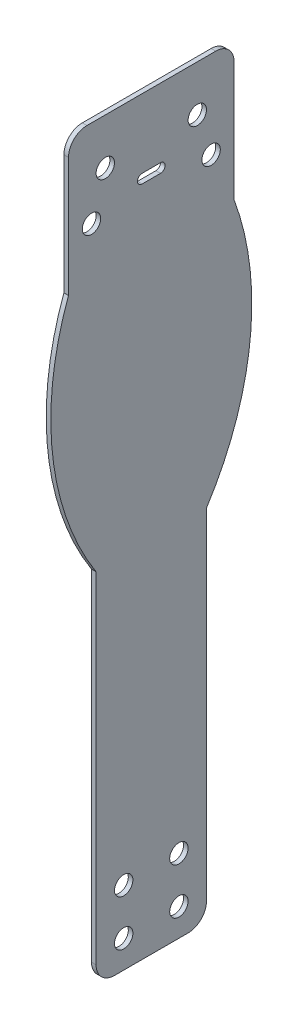
from build123d import *

# Parameters (mm, degrees)
BOSS_EXTRUDE1_DEPTH      = 1
F_4_0_4_DIAMETER_HOLE3_D = 4
F_4_0_4_DIAMETER_HOLE2_D = 4
CUT_EXTRUDE1_DEPTH       = 165.459779279
F_4_0_4_DIAMETER_HOLE1_D = 4
LPATTERN1_COUNT          = 2
LPATTERN1_PITCH          = 10
FILLET1_R                = 4


with BuildPart() as part:
    # Sketch1 → Boss-Extrude1 (new body)
    with BuildSketch(Plane(origin=(0, 0, 0), x_dir=(0, 0, -1), z_dir=(1, 0, 0))):
        with BuildLine():
            Line((12, -163), (12, -85))
            ThreePointArc((12, -85), (21.475099597, -58.206374501), (18, -30))
            Line((18, -30), (18, 0))
            Line((18, 0), (-18, 0))
            Line((-18, 0), (-18, -30))
            ThreePointArc((-18, -30), (-21.475099597, -58.206374501), (-12, -85))
            Line((-12, -85), (-12, -163))
            Line((-12, -163), (12, -163))
        make_face()
    extrude(amount=BOSS_EXTRUDE1_DEPTH)

    # Ø4.0 (4) Diameter Hole3 (through all)
    with Locations(Plane.ZY):
        with Locations((10, -10), (-10, -10)):
            Hole(F_4_0_4_DIAMETER_HOLE3_D / 2)

    # Ø4.0 (4) Diameter Hole2 (through all)
    with Locations(Plane.ZY):
        with Locations((-13, -19), (13, -19)):
            Hole(F_4_0_4_DIAMETER_HOLE2_D / 2)

    # Sketch10 → Cut-Extrude1 (cut, through all)
    with BuildSketch(Plane(origin=(1, 0, 0), x_dir=(0, 0, -1), z_dir=(1, 0, 0))):
        with BuildLine():
            Line((-2, -15), (2, -15))
            ThreePointArc((2, -15), (3, -16), (2, -17))
            Line((2, -17), (-2, -17))
            ThreePointArc((-2, -17), (-3, -16), (-2, -15))
        make_face()
    extrude(amount=-CUT_EXTRUDE1_DEPTH, mode=Mode.SUBTRACT)

    # Ø4.0 (4) Diameter Hole1 (through all)
    with Locations(Plane(origin=(1, 0, 0), x_dir=(0, 0, -1), z_dir=(1, 0, 0))):
        with Locations((-6, -157), (6, -157)):
            f_4_0_4_diameter_hole1 = Hole(F_4_0_4_DIAMETER_HOLE1_D / 2)

    # LPattern1: Ø4.0 (4) Diameter Hole1 ×2
    with Locations(*[(0, i * LPATTERN1_PITCH, 0) for i in range(1, LPATTERN1_COUNT)]):
        add(f_4_0_4_diameter_hole1, mode=Mode.SUBTRACT)

    # Fillet1
    fillet1_edges = [part.edges().sort_by_distance(p)[0] for p in [
        (0.5, 0, 18),
        (0.5, 0, -18),
        (0.5, -163, -12),
        (0.5, -163, 12),
    ]]
    fillet(fillet1_edges, radius=FILLET1_R)


solid = part.part
